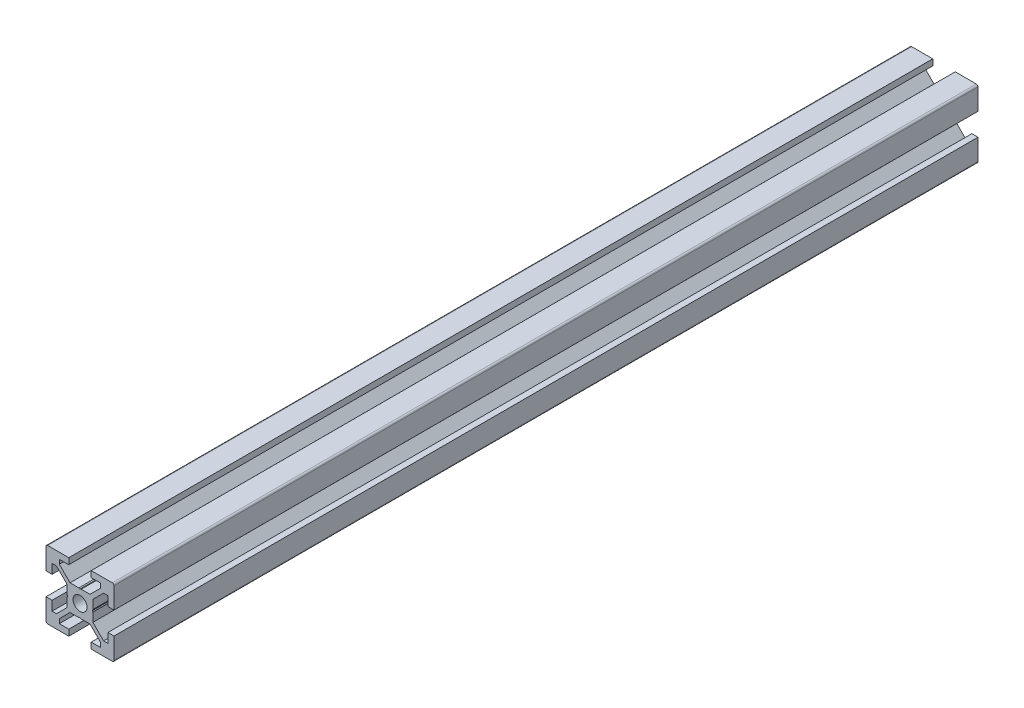
from build123d import *

# Parameters (mm, degrees)
SKETCH1_R           = 2.05
BOSS_EXTRUDE1_DEPTH = 254
FILLET1_R           = 0.5


with BuildPart() as part:
    # Sketch1 → Boss-Extrude1 (new body)
    with BuildSketch(Plane.XY):
        Polygon((-3.3, 10), (-3.3, 8.2), (-6.08, 8.2), (-6.08, 6.928528137), (-2.931471863, 3.78), (-0.34, 3.78), (0, 3.66), (0.34, 3.78), (2.931471863, 3.78), (6.08, 6.928528137), (6.08, 8.2), (3.3, 8.2), (3.3, 10), (10, 10), (10, 3.3), (8.2, 3.3), (8.2, 6.08), (6.928528137, 6.08), (3.78, 2.931471863), (3.78, 0.34), (3.66, 0), (3.78, -0.34), (3.78, -2.931471863), (6.928528137, -6.08), (8.2, -6.08), (8.2, -3.3), (10, -3.3), (10, -10), (3.3, -10), (3.3, -8.2), (6.08, -8.2), (6.08, -6.928528137), (2.931471863, -3.78), (0.34, -3.78), (0, -3.66), (-0.34, -3.78), (-2.931471863, -3.78), (-6.08, -6.928528137), (-6.08, -8.2), (-3.3, -8.2), (-3.3, -10), (-10, -10), (-10, -3.3), (-8.2, -3.3), (-8.2, -6.08), (-6.928528137, -6.08), (-3.78, -2.931471863), (-3.78, -0.34), (-3.66, 0), (-3.78, 0.34), (-3.78, 2.931471863), (-6.928528137, 6.08), (-8.2, 6.08), (-8.2, 3.3), (-10, 3.3), (-10, 10), align=None)
        Circle(SKETCH1_R, mode=Mode.SUBTRACT)
    extrude(amount=BOSS_EXTRUDE1_DEPTH)

    # Fillet1
    fillet1_edges = [part.edges().sort_by_distance(p)[0] for p in [
        (10, 10, 127),
        (10, -10, 127),
        (-10, -10, 127),
        (-10, 10, 127),
    ]]
    fillet(fillet1_edges, radius=FILLET1_R)


solid = part.part
